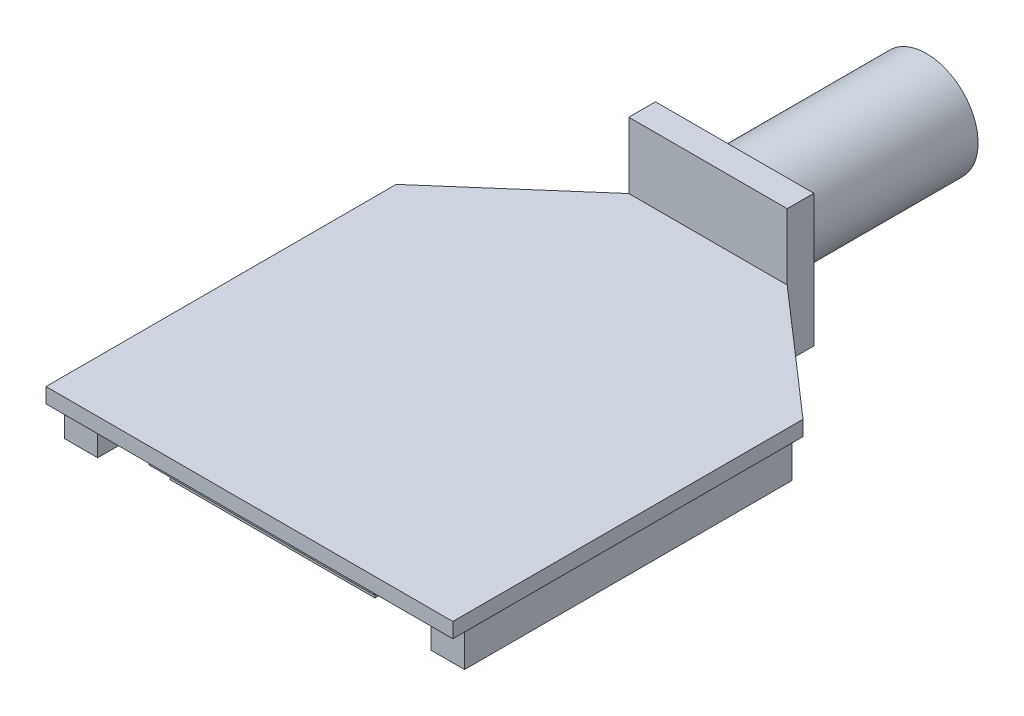
from build123d import *

# Parameters (mm, degrees)
BOSS_EXTRUDE1_DEPTH = 0.9
SKETCH2_W           = 9.5
SKETCH2_H           = 7.93
BOSS_EXTRUDE2_DEPTH = 1.6
SKETCH3_R           = 3.1
BOSS_EXTRUDE3_DEPTH = 11.5
SKETCH4_W           = 2
SKETCH4_H           = 19.64
BOSS_EXTRUDE4_DEPTH = 2.15
SKETCH5_W           = 13.5
SKETCH5_H           = 19.3
BOSS_EXTRUDE5_DEPTH = 0.8
SKETCH6_W           = 12.288283072
SKETCH6_H           = 15.069258514
BOSS_EXTRUDE6_DEPTH = 0.8


with BuildPart() as part:
    # Sketch1 → Boss-Extrude1 (new body)
    with BuildSketch(Plane(origin=(0, 0, 0), x_dir=(1, 0, 0), z_dir=(0, 1, 0))):
        Polygon((-12.2, 10.5), (-12.2, -10.5), (12.2, -10.5), (12.2, 10.5), (4.75, 17), (-4.75, 17), align=None)
    extrude(amount=BOSS_EXTRUDE1_DEPTH)

    # Sketch2 → Boss-Extrude2 (add)
    with BuildSketch(Plane(origin=(0, 0, -17), x_dir=(-1, 0, 0), z_dir=(0, 0, -1))):
        with Locations((0, 0.9)):
            Rectangle(SKETCH2_W, SKETCH2_H)
    extrude(amount=BOSS_EXTRUDE2_DEPTH)

    # Sketch3 → Boss-Extrude3 (add)
    with BuildSketch(Plane(origin=(0, 0, -18.6), x_dir=(-1, 0, 0), z_dir=(0, 0, -1))):
        with Locations((0, 0.9)):
            Circle(SKETCH3_R)
    extrude(amount=BOSS_EXTRUDE3_DEPTH)

    # Sketch4 → Boss-Extrude4 (add)
    with BuildSketch(Plane.XZ):
        with Locations((-11, -0.22)):
            Rectangle(SKETCH4_W, SKETCH4_H)
    boss_extrude4 = extrude(amount=BOSS_EXTRUDE4_DEPTH)

    # Mirror1: Boss-Extrude4 across plane
    add(boss_extrude4.mirror(Plane(origin=(0, 0, 0), x_dir=(0, 0, 1), z_dir=(1, 0, 0))))

    # Sketch5 → Boss-Extrude5 (add)
    with BuildSketch(Plane.XZ):
        with Locations((0, 0.137773352)):
            Rectangle(SKETCH5_W, SKETCH5_H)
    extrude(amount=BOSS_EXTRUDE5_DEPTH)

    # Sketch6 → Boss-Extrude6 (add)
    with BuildSketch(Plane.XZ.offset(0.8)):
        with Locations((0, 1.584615241)):
            Rectangle(SKETCH6_W, SKETCH6_H)
    extrude(amount=BOSS_EXTRUDE6_DEPTH)


solid = part.part
